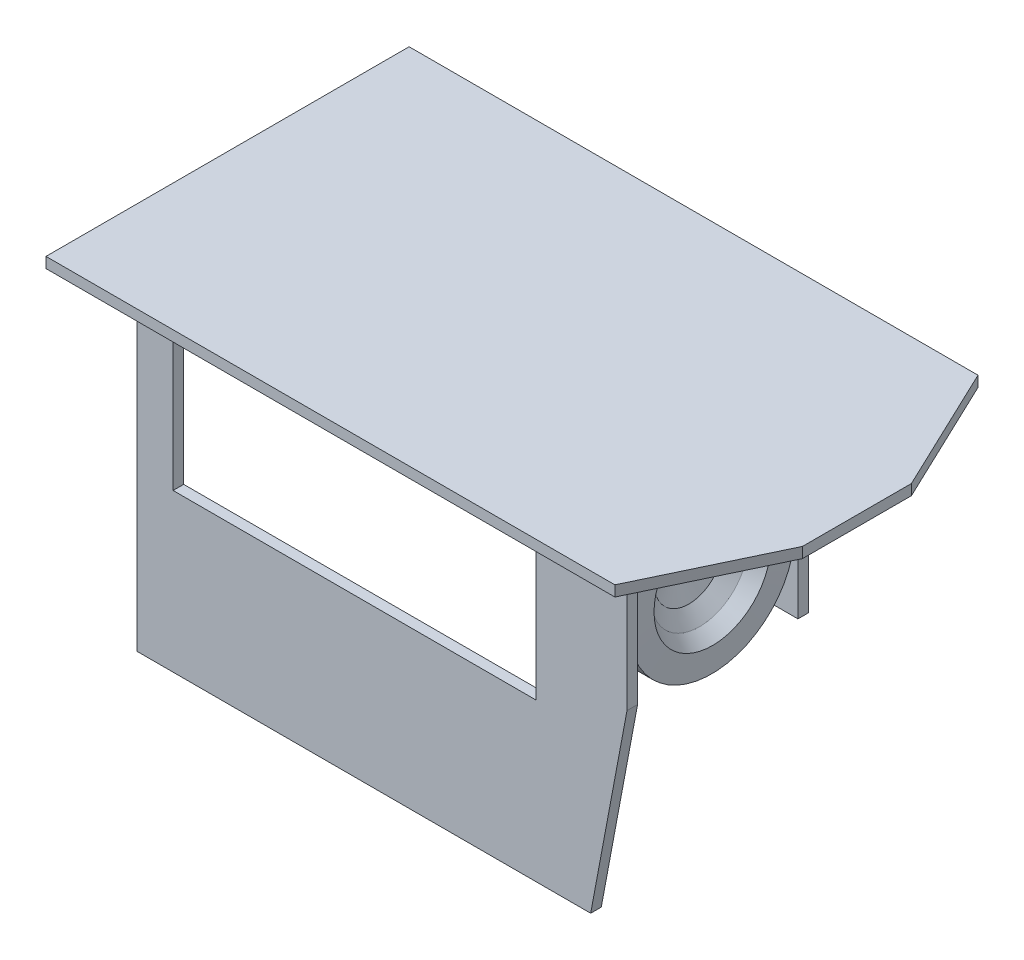
from build123d import *

# Parameters (mm, degrees)
PLACA_SUPERIOR_ACROMION_DEPTH  = 3.5
PLACA_POSTERIOR_ESCAPULA_DEPTH = 3.5
SKETCH3_W                      = 140
SKETCH3_H                      = 64
PLACA_ANTERIOR_DEPTH           = 3.5
SKETCH4_W                      = 22
SKETCH4_H                      = 20
CUELLO_GLENOIDEO_DEPTH         = 54
SKETCH6_W                      = 120
SKETCH6_H                      = 56
VENTANA_POSTERIOR_DEPTH        = 6
SKETCH7_W                      = 100
SKETCH7_H                      = 26
VENTANA_ANTERIOR_DEPTH         = 6


with BuildPart() as part:
    # Sketch1 → Placa_superior_acromion (new body)
    with BuildSketch(Plane(origin=(0, 38.5, 0), x_dir=(1, 0, 0), z_dir=(0, 1, 0))):
        Polygon((-172, -60), (16, -60), (36, -18), (36, 18), (16, 60), (-172, 60), align=None)
    extrude(amount=PLACA_SUPERIOR_ACROMION_DEPTH)

    # Sketch2 → Placa_posterior_escapula (add)
    with BuildSketch(Plane.XY.offset(26.5)):
        Polygon((-172, 40), (-10, 40), (-10, -22), (-22, -86), (-172, -86), align=None)
    extrude(amount=PLACA_POSTERIOR_ESCAPULA_DEPTH)

    # Sketch3 → Placa_anterior (add)
    with BuildSketch(Plane.XY.offset(-30)):
        with Locations((-80, 8)):
            Rectangle(SKETCH3_W, SKETCH3_H)
    extrude(amount=PLACA_ANTERIOR_DEPTH)

    # Sketch4 → Cuello_glenoideo (add)
    with BuildSketch(Plane.XY.offset(-27)):
        with Locations((-25, 30)):
            Rectangle(SKETCH4_W, SKETCH4_H)
    extrude(amount=CUELLO_GLENOIDEO_DEPTH)

    # Sketch5 → Cavidad_glenoidea (revolve)
    with BuildSketch(Plane.XY, mode=Mode.PRIVATE) as cavidad_glenoidea_sk:
        Polygon((-36, 0), (-36, 27.5), (-12, 27.5), (-11.77481768, 19.290248018), (-15.980613255, 15.980613255), (-19.572174126, 11.3), (-21.829923674, 5.849310419), (-22.6, 0), align=None)
    revolve(cavidad_glenoidea_sk.sketch.rotate(Axis((-40, 0, 0), (1, 0, 0)), 90), axis=Axis((-40, 0, 0), (1, 0, 0)))

    # Sketch6 → Ventana_posterior (cut)
    with BuildSketch(Plane.XY.offset(25)):
        with Locations((-100, -6)):
            Rectangle(SKETCH6_W, SKETCH6_H)
    extrude(amount=VENTANA_POSTERIOR_DEPTH, mode=Mode.SUBTRACT)

    # Sketch7 → Ventana_anterior (cut)
    with BuildSketch(Plane.XY.offset(-31)):
        with Locations((-90, -3)):
            Rectangle(SKETCH7_W, SKETCH7_H)
    extrude(amount=VENTANA_ANTERIOR_DEPTH, mode=Mode.SUBTRACT)


solid = part.part
